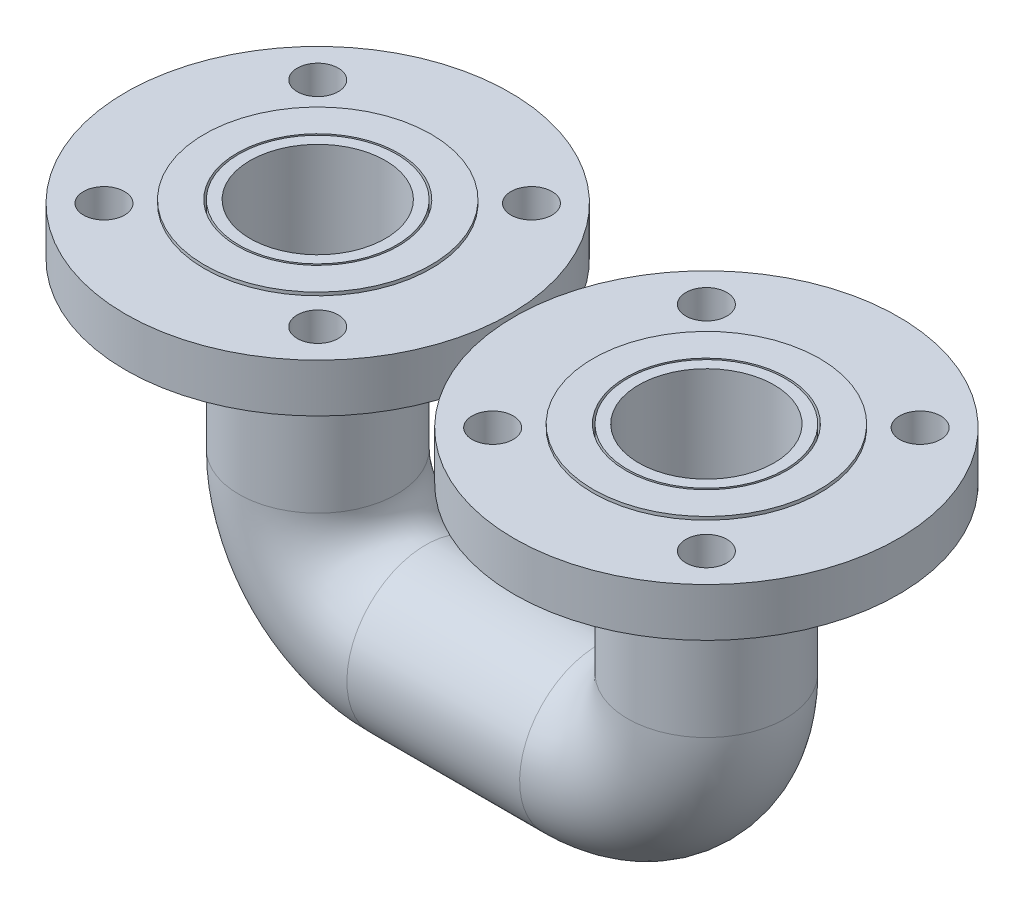
from build123d import *

# Parameters (mm, degrees)
SKETCH1_R           = 89
SKETCH1_R_2         = 37.35
SKETCH1_R_3         = 9.5
BOSS_EXTRUDE1_DEPTH = 22.4
SKETCH2_R           = 52.5
SKETCH2_R_2         = 37.35
BOSS_EXTRUDE2_DEPTH = 1.5
SKETCH5_R           = 36.5
SKETCH5_R_2         = 31.34


with BuildPart() as part:
    # Sketch1 → Boss-Extrude1 (new body)
    with BuildSketch(Plane(origin=(0, 0, 0), x_dir=(1, 0, 0), z_dir=(0, 1, 0))):
        with Locations(Location((0, 0, 0), (0, 0, 270))):
            Circle(SKETCH1_R)
        with Locations(Location((0, 0, 0), (0, 0, 270))):
            Circle(SKETCH1_R_2, mode=Mode.SUBTRACT)
        with Locations(Location((-49.497474683, 49.497474683, 0), (0, 0, 270))):
            Circle(SKETCH1_R_3, mode=Mode.SUBTRACT)
        with Locations(Location((-49.497474683, -49.497474683, 0), (0, 0, 90))):
            Circle(SKETCH1_R_3, mode=Mode.SUBTRACT)
        with Locations(Location((49.497474683, -49.497474683, 0), (0, 0, 270))):
            Circle(SKETCH1_R_3, mode=Mode.SUBTRACT)
        with Locations(Location((49.497474683, 49.497474683, 0), (0, 0, 90))):
            Circle(SKETCH1_R_3, mode=Mode.SUBTRACT)
    extrude(amount=BOSS_EXTRUDE1_DEPTH)

    # Sketch2 → Boss-Extrude2 (add)
    with BuildSketch(Plane(origin=(0, 22.4, 0), x_dir=(1, 0, 0), z_dir=(0, 1, 0))):
        with Locations(Location((0, 0, 0), (0, 0, 270))):
            Circle(SKETCH2_R)
        with Locations(Location((0, 0, 0), (0, 0, 270))):
            Circle(SKETCH2_R_2, mode=Mode.SUBTRACT)
    extrude(amount=BOSS_EXTRUDE2_DEPTH)


with BuildPart() as body_2:
    # Mirror3: mirrored copy
    add(part.part.mirror(Plane(origin=(90, 0, 0), x_dir=(0, 0, 1), z_dir=(1, 0, 0))))


with BuildPart() as body_3:
    # Sweep2: sweep along a path in Sketch3
    with BuildLine(Plane.XY) as sweep2_path:
        Line((0, 23.9), (0, -76.1))
        ThreePointArc((0, -76.1), (14.644660941, -111.455339059), (50, -126.1))
        Line((50, -126.1), (130, -126.1))
        ThreePointArc((130, -126.1), (165.355339059, -111.455339059), (180, -76.1))
        Line((180, -76.1), (180, 23.9))
    # Sketch5 → Sweep2 (sweep)
    with BuildSketch(Plane(origin=(0, 23.9, 0), x_dir=(1, 0, 0), z_dir=(0, 1, 0))):
        Circle(SKETCH5_R)
        Circle(SKETCH5_R_2, mode=Mode.SUBTRACT)
    sweep(path=sweep2_path.line)


solid = Compound([part.part, body_2.part, body_3.part])
